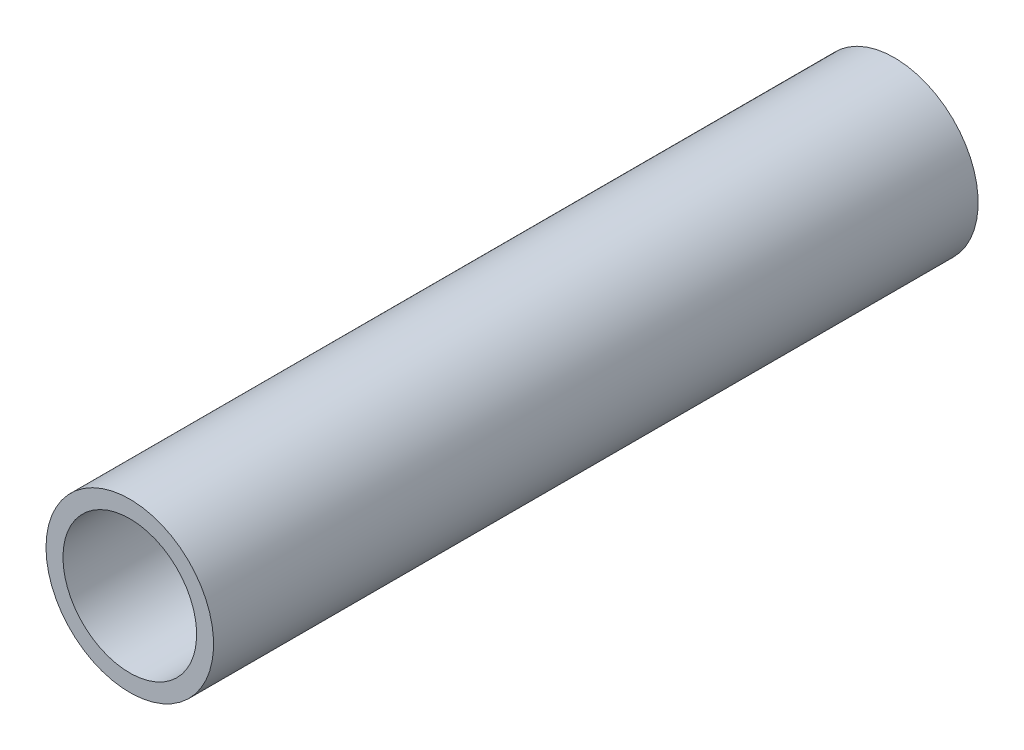
from build123d import *

# Parameters (mm, degrees)
SKETCH1_R           = 16.7005
SKETCH1_R_2         = 13.3223
EXTRUDE_THIN1_DEPTH = 76.2


with BuildPart() as part:
    # Sketch1 → Extrude-Thin1 (new, symmetric)
    with BuildSketch(Plane.XY):
        Circle(SKETCH1_R)
        Circle(SKETCH1_R_2, mode=Mode.SUBTRACT)
    extrude(amount=EXTRUDE_THIN1_DEPTH, both=True)


solid = part.part
